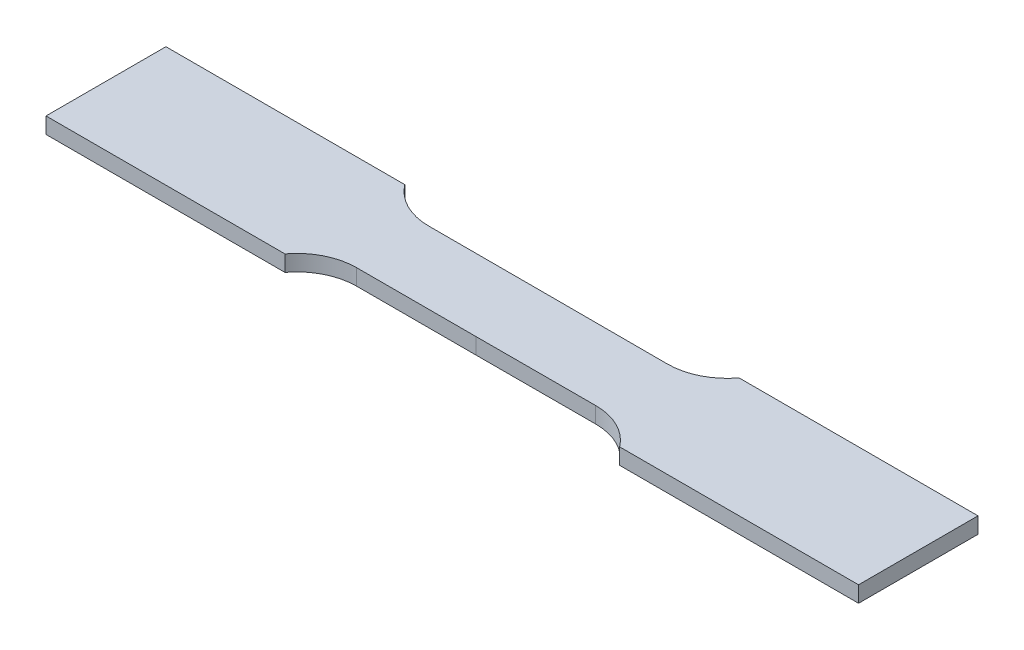
from build123d import *

# Parameters (mm, degrees)
BOSS_EXTRUDE2_DEPTH = 3.357


with BuildPart() as part:
    # Sketch1 → Boss-Extrude2 (new body)
    with BuildSketch(Plane(origin=(0, 0, 0), x_dir=(1, 0, 0), z_dir=(0, 1, 0))):
        with BuildLine():
            Line((35, 12.498355963), (85, 12.498355963))
            Line((85, 12.498355963), (85, -12.498355963))
            Line((85, -12.498355963), (35, -12.498355963))
            ThreePointArc((35, -12.498355963), (30.587768191, -8.827215395), (25, -7.515))
            Line((25, -7.515), (0, -7.54))
            Line((0, -7.54), (-25, -7.545))
            ThreePointArc((-25, -7.545), (-30.590651583, -8.866151179), (-35, -12.548334241))
            Line((-35, -12.548334241), (-85, -12.548334241))
            Line((-85, -12.548334241), (-85, 12.548334241))
            Line((-85, 12.548334241), (-35, 12.548334241))
            ThreePointArc((-35, 12.548334241), (-30.590651583, 8.866151179), (-25, 7.545))
            Line((-25, 7.545), (0, 7.54))
            Line((0, 7.54), (25, 7.515))
            ThreePointArc((25, 7.515), (30.587768191, 8.827215395), (35, 12.498355963))
        make_face()
    extrude(amount=BOSS_EXTRUDE2_DEPTH)


solid = part.part
